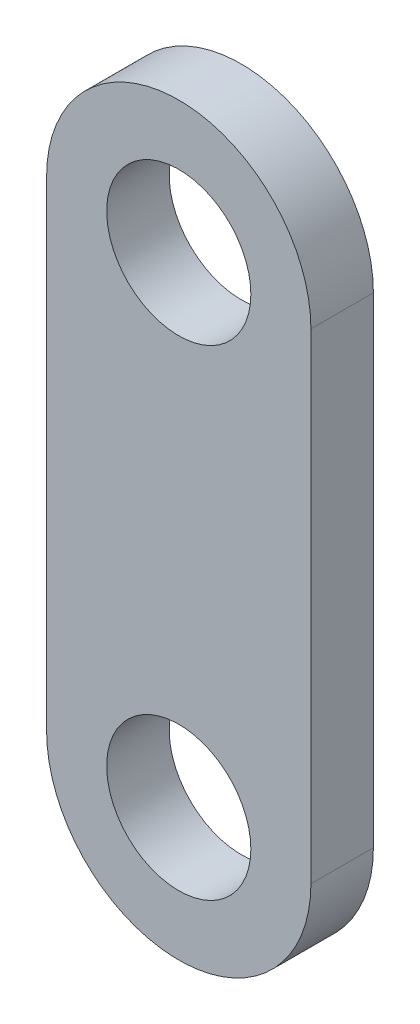
from build123d import *

# Parameters (mm, degrees)
SKETCH_1_R      = 3
EXTRUDE_1_DEPTH = 2.6


with BuildPart() as part:
    # 草图1 → 凸台-拉伸1 (new body)
    with BuildSketch(Plane.XY):
        with BuildLine():
            Line((5.5, 10), (5.5, -10))
            ThreePointArc((5.5, -10), (0, -15.5), (-5.5, -10))
            Line((-5.5, -10), (-5.5, 10))
            ThreePointArc((-5.5, 10), (0, 15.5), (5.5, 10))
        make_face()
        with Locations((0, -10)):
            Circle(SKETCH_1_R, mode=Mode.SUBTRACT)
        with Locations((0, 10)):
            Circle(SKETCH_1_R, mode=Mode.SUBTRACT)
    extrude(amount=EXTRUDE_1_DEPTH)


solid = part.part
